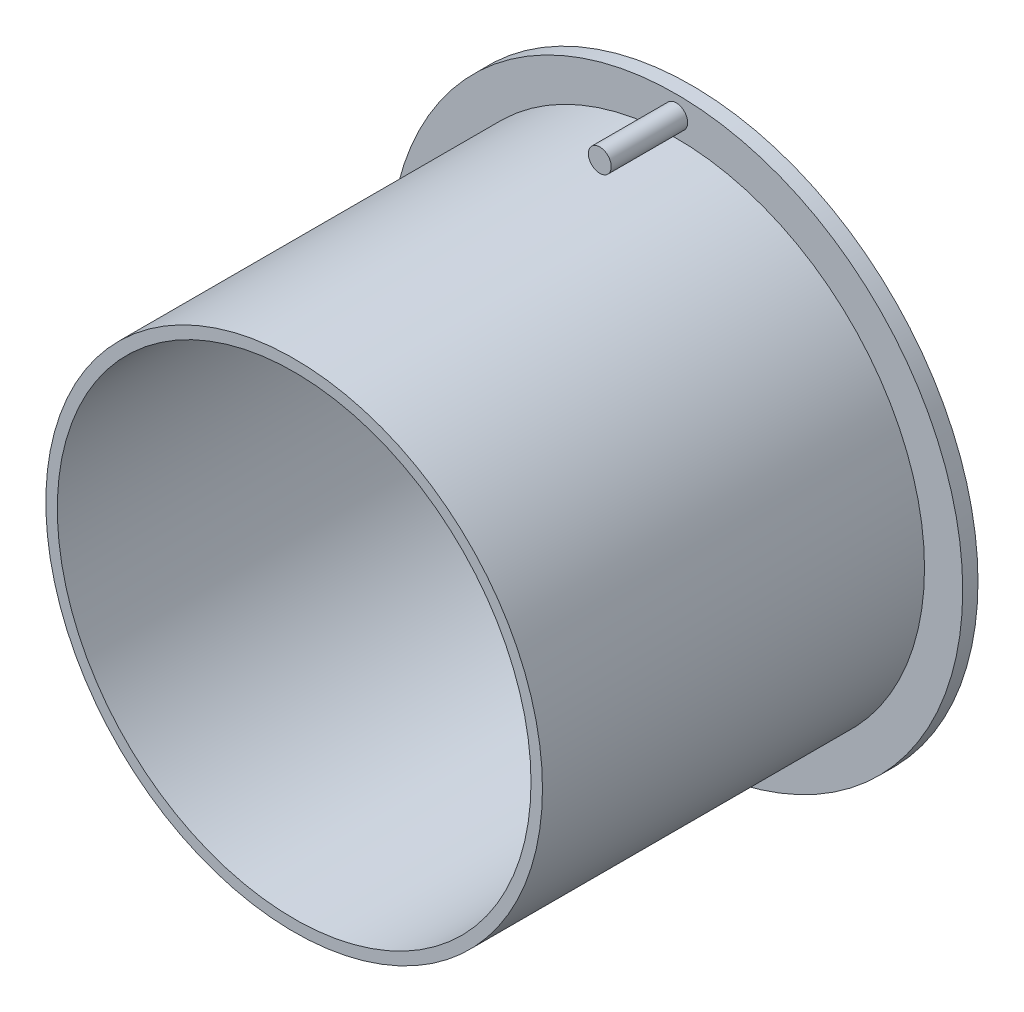
from build123d import *

# Parameters (mm, degrees)
SKETCH1_R           = 37.5
SKETCH1_R_2         = 32.5
SKETCH1_R_3         = 31
BOSS_EXTRUDE1_DEPTH = 2
SKETCH2_R           = 32.5
SKETCH2_R_2         = 31
BOSS_EXTRUDE2_DEPTH = 55
SKETCH8_R           = 1.5
BOSS_EXTRUDE3_DEPTH = 10
CUT_EXTRUDE1_START  = -5
SKETCH9_R           = 32.5
SKETCH9_R_2         = 31
CUT_EXTRUDE1_DEPTH  = 5
SKETCH10_R          = 12.5
CUT_EXTRUDE3_DEPTH  = 100


with BuildPart() as part:
    # Sketch1 → Boss-Extrude1 (new body)
    # profile 1 of 3: a face of its own
    with BuildSketch(Plane.XY):
        Circle(SKETCH1_R)
        Circle(SKETCH1_R_2, mode=Mode.SUBTRACT)
    # profile 2 of 3: a face of its own
    with BuildSketch(Plane.XY):
        Circle(SKETCH1_R_2)
        Circle(SKETCH1_R_3, mode=Mode.SUBTRACT)
    # profile 3 of 3: a face of its own
    with BuildSketch(Plane.XY):
        Circle(SKETCH1_R_3)
    extrude(amount=-BOSS_EXTRUDE1_DEPTH)

    # Sketch2 → Boss-Extrude2 (add)
    with BuildSketch(Plane.XY):
        Circle(SKETCH2_R)
        Circle(SKETCH2_R_2, mode=Mode.SUBTRACT)
    extrude(amount=BOSS_EXTRUDE2_DEPTH)

    # Sketch8 → Boss-Extrude3 (add)
    with BuildSketch(Plane.XY):
        with Locations((0, 35)):
            Circle(SKETCH8_R)
        with Locations((0, -35)):
            Circle(SKETCH8_R)
    extrude(amount=BOSS_EXTRUDE3_DEPTH)

    # Sketch9 → Cut-Extrude1 (cut)
    with BuildSketch(Plane.XY.offset(55).offset(CUT_EXTRUDE1_START)):
        Circle(SKETCH9_R)
        Circle(SKETCH9_R_2, mode=Mode.SUBTRACT)
    extrude(amount=CUT_EXTRUDE1_DEPTH, mode=Mode.SUBTRACT)

    # Sketch10 → Cut-Extrude3 (cut)
    with BuildSketch(Plane(origin=(0, 0, -2), x_dir=(-1, 0, 0), z_dir=(0, 0, -1))):
        with Locations((0, 16.96)):
            Circle(SKETCH10_R)
    extrude(amount=-CUT_EXTRUDE3_DEPTH, mode=Mode.SUBTRACT)


solid = part.part
